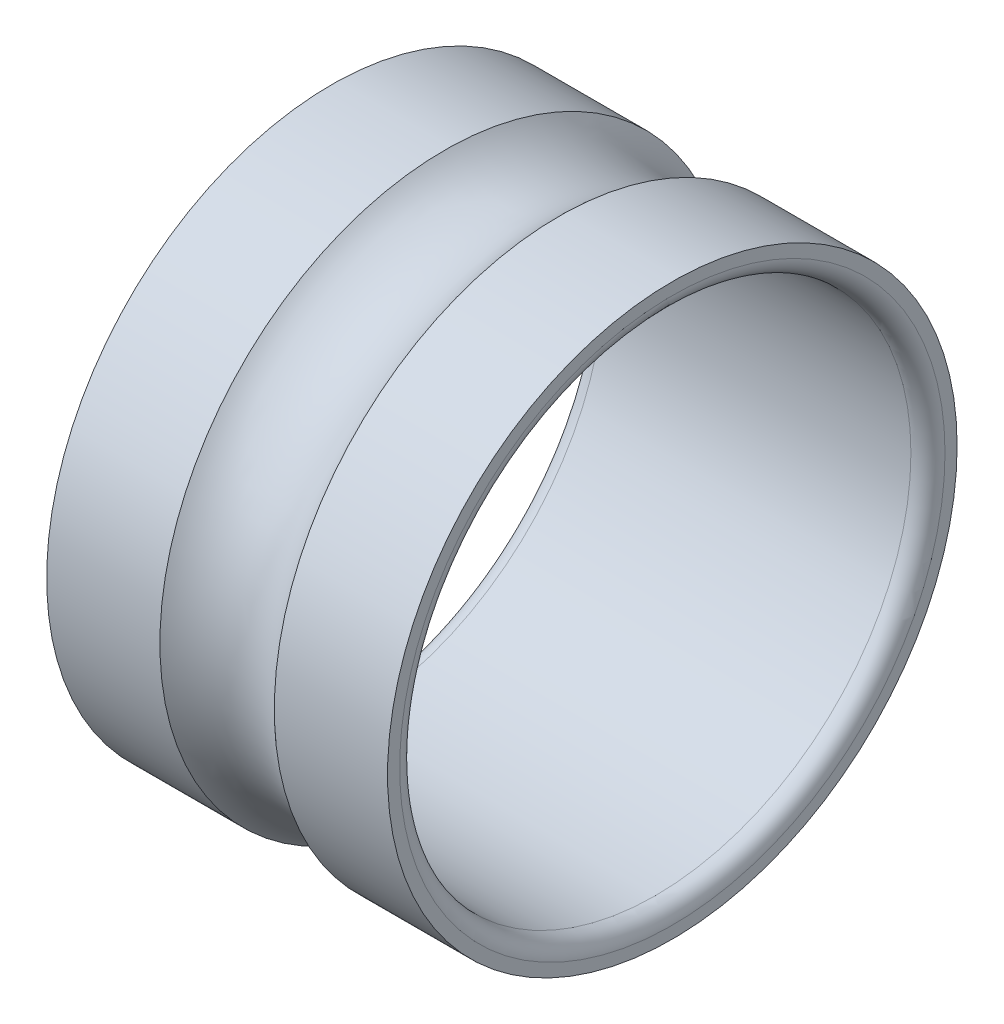
from build123d import *


with BuildPart() as part:
    # Sketch1 → Revolve1 (revolve)
    with BuildSketch(Plane.XY, mode=Mode.PRIVATE) as revolve1_sk:
        with BuildLine():
            Line((-1.42875, 2.38125), (1.42875, 2.38125))
            ThreePointArc((1.42875, 2.38125), (1.541003202, 2.427746798), (1.5875, 2.54))
            Line((1.5875, 2.54), (1.5875, 2.6527125))
            Line((1.5875, 2.6527125), (0.532839829, 2.6527125))
            ThreePointArc((0.532839829, 2.6527125), (0, 2.428875), (-0.532839829, 2.6527125))
            Line((-0.532839829, 2.6527125), (-1.5875, 2.6527125))
            Line((-1.5875, 2.6527125), (-1.5875, 2.54))
            ThreePointArc((-1.5875, 2.54), (-1.541003202, 2.427746798), (-1.42875, 2.38125))
        make_face()
    revolve(revolve1_sk.sketch.rotate(Axis((-1.5875, 0, 0), (1, 0, 0)), 270), axis=Axis((-1.5875, 0, 0), (1, 0, 0)))


solid = part.part
